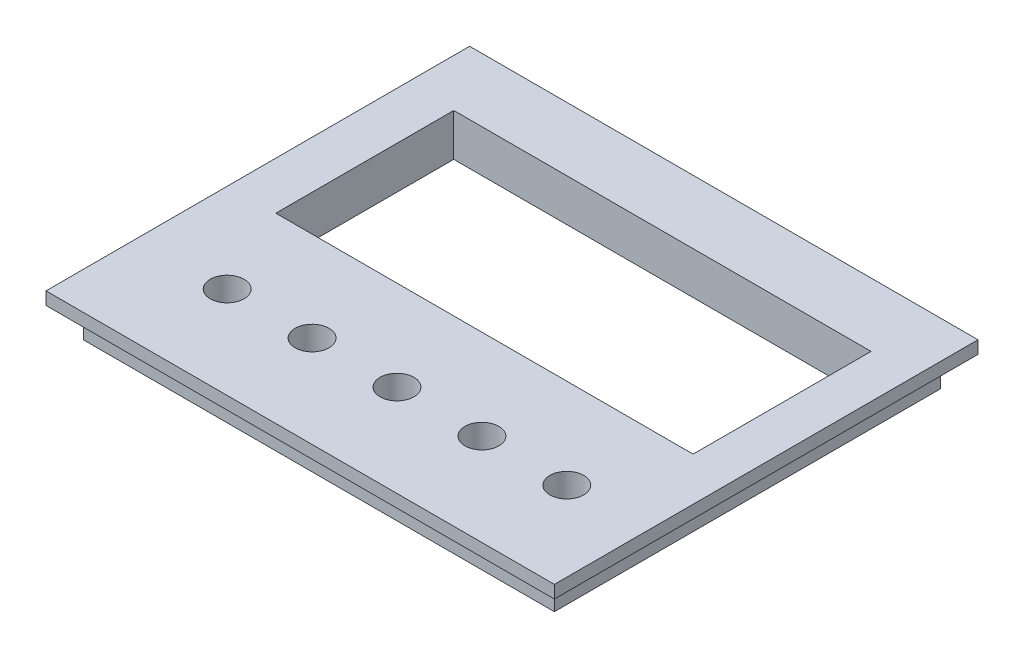
from build123d import *

# Parameters (mm, degrees)
SKETCH1_W           = 120
SKETCH1_H           = 100
BOSS_EXTRUDE1_DEPTH = 10
SKETCH2_W           = 98.5
SKETCH2_H           = 42
CUT_EXTRUDE1_DEPTH  = 10
SKETCH3_W           = 120
SKETCH3_H           = 100
SKETCH3_W_2         = 111.2
SKETCH3_H_2         = 91.2
CUT_EXTRUDE3_DEPTH  = 7
SKETCH4_W           = 18
SKETCH4_H           = 25
CUT_EXTRUDE4_DEPTH  = 4
SKETCH5_W           = 3
SKETCH5_H           = 25
CUT_EXTRUDE6_DEPTH  = 2.5
SKETCH6_R           = 4
CUT_EXTRUDE12_DEPTH = 80.892767694


with BuildPart() as part:
    # Sketch1 → Boss-Extrude1 (new body)
    with BuildSketch(Plane(origin=(0, 0, 0), x_dir=(1, 0, 0), z_dir=(0, 1, 0))):
        with Locations((0.311320755, 2.051886792)):
            Rectangle(SKETCH1_W, SKETCH1_H)
    extrude(amount=BOSS_EXTRUDE1_DEPTH)

    # Sketch2 → Cut-Extrude1 (cut)
    with BuildSketch(Plane(origin=(0, 10, 0), x_dir=(1, 0, 0), z_dir=(0, 1, 0))):
        with Locations((0.811320755, 16.051886792)):
            Rectangle(SKETCH2_W, SKETCH2_H)
    extrude(amount=-CUT_EXTRUDE1_DEPTH, mode=Mode.SUBTRACT)

    # Sketch3 → Cut-Extrude3 (cut)
    with BuildSketch(Plane.XZ):
        with Locations((0.311320755, -2.051886792)):
            Rectangle(SKETCH3_W, SKETCH3_H)
        with Locations((0.311320755, -2.051886792)):
            Rectangle(SKETCH3_W_2, SKETCH3_H_2, mode=Mode.SUBTRACT)
    extrude(amount=-CUT_EXTRUDE3_DEPTH, mode=Mode.SUBTRACT)

    # Sketch4 → Cut-Extrude4 (cut)
    with BuildSketch(Plane.XZ):
        with Locations((-39.17934754, 29.448113208)):
            Rectangle(SKETCH4_W, SKETCH4_H)
        with Locations((-19.133803456, 29.448113208)):
            Rectangle(SKETCH4_W, SKETCH4_H)
        with Locations((0.911740628, 29.448113208)):
            Rectangle(SKETCH4_W, SKETCH4_H)
        with Locations((20.957284712, 29.448113208)):
            Rectangle(SKETCH4_W, SKETCH4_H)
        with Locations((41.002828796, 29.448113208)):
            Rectangle(SKETCH4_W, SKETCH4_H)
    extrude(amount=-CUT_EXTRUDE4_DEPTH, mode=Mode.SUBTRACT)

    # Sketch5 → Cut-Extrude6 (cut)
    with BuildSketch(Plane.XZ.offset(-4)):
        with Locations((33.502828796, 29.448113208)):
            Rectangle(SKETCH5_W, SKETCH5_H)
        with Locations((13.457284712, 29.448113208)):
            Rectangle(SKETCH5_W, SKETCH5_H)
        with Locations((-6.588259372, 29.448113208)):
            Rectangle(SKETCH5_W, SKETCH5_H)
        with Locations((-26.633803456, 29.448113208)):
            Rectangle(SKETCH5_W, SKETCH5_H)
        with Locations((-46.67934754, 29.448113208)):
            Rectangle(SKETCH5_W, SKETCH5_H)
    extrude(amount=-CUT_EXTRUDE6_DEPTH, mode=Mode.SUBTRACT)

    # Sketch6 → Cut-Extrude12 (cut, through all)
    with BuildSketch(Plane.XZ.offset(-4)):
        with Locations(Location((41.502828796, 26.198113208, 0), (0, 0, 270))):
            Circle(SKETCH6_R)
        with Locations(Location((21.457284712, 26.198113208, 0), (0, 0, 270))):
            Circle(SKETCH6_R)
        with Locations(Location((1.411740628, 26.198113208, 0), (0, 0, 270))):
            Circle(SKETCH6_R)
        with Locations(Location((-18.633803456, 26.198113208, 0), (0, 0, 270))):
            Circle(SKETCH6_R)
        with Locations(Location((-38.67934754, 26.198113208, 0), (0, 0, 270))):
            Circle(SKETCH6_R)
    extrude(amount=-CUT_EXTRUDE12_DEPTH, mode=Mode.SUBTRACT)


solid = part.part
